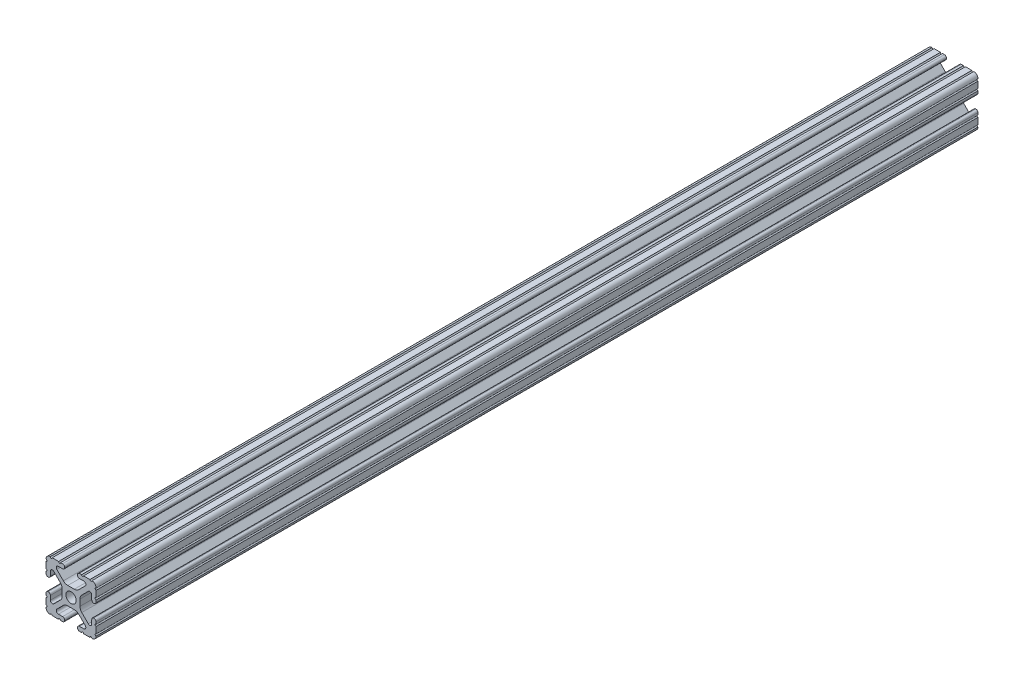
from build123d import *

# Parameters (mm, degrees)
SKETCH1_R           = 2.6035
BOSS_EXTRUDE1_DEPTH = 223.52


with BuildPart() as part:
    # Sketch1 → Boss-Extrude1 (new, symmetric)
    with BuildSketch(Plane.XY):
        with BuildLine():
            Line((-7.179650497, -8.645192506), (-3.952270251, -5.423690499))
            ThreePointArc((-3.952270251, -5.423690499), (-2.922936451, -4.736929036), (-1.709253557, -4.4958))
            Line((-1.709253557, -4.4958), (1.709253557, -4.4958))
            ThreePointArc((1.709253557, -4.4958), (2.922936451, -4.736929036), (3.952270251, -5.423690499))
            Line((3.952270251, -5.423690499), (7.179650497, -8.645192506))
            ThreePointArc((7.179650497, -8.645192506), (7.41473083, -9.822813117), (6.416408329, -10.4902))
            Line((6.416408329, -10.4902), (4.287512407, -10.4902))
            ThreePointArc((4.287512407, -10.4902), (3.54574862, -10.79744862), (3.2385, -11.539212407))
            Line((3.2385, -11.539212407), (3.2385, -11.650987593))
            ThreePointArc((3.2385, -11.650987593), (3.54574862, -12.39275138), (4.287512407, -12.7))
            Line((4.287512407, -12.7), (5.317126718, -12.7))
            ThreePointArc((5.317126718, -12.7), (5.825126718, -12.192), (6.333126718, -12.7))
            Line((6.333126718, -12.7), (9.550443118, -12.7))
            ThreePointArc((9.550443118, -12.7), (10.058366869, -12.192000006), (10.566443095, -12.699847501))
            ThreePointArc((10.566443095, -12.699847501), (12.082537762, -12.08250727), (12.699846982, -10.566399977))
            ThreePointArc((12.699846982, -10.566399977), (12.192000006, -10.058323491), (12.7, -9.5504))
            Line((12.7, -9.5504), (12.7, -6.3330836))
            ThreePointArc((12.7, -6.3330836), (12.192, -5.8250836), (12.7, -5.3170836))
            Line((12.7, -5.3170836), (12.7, -4.287469289))
            ThreePointArc((12.7, -4.287469289), (12.39275138, -3.545705502), (11.650987593, -3.238456882))
            Line((11.650987593, -3.238456882), (11.539212407, -3.238456882))
            ThreePointArc((11.539212407, -3.238456882), (10.79744862, -3.545705502), (10.4902, -4.287469289))
            Line((10.4902, -4.287469289), (10.4902, -6.402089023))
            ThreePointArc((10.4902, -6.402089023), (9.856505071, -7.351067942), (8.737131347, -7.129408934))
            Line((8.737131347, -7.129408934), (5.441005833, -3.840816462))
            ThreePointArc((5.441005833, -3.840816462), (4.750877967, -2.809883091), (4.5085, -1.593185507))
            Line((4.5085, -1.593185507), (4.5085, 1.593185507))
            ThreePointArc((4.5085, 1.593185507), (4.750877967, 2.809883091), (5.441005833, 3.840816462))
            Line((5.441005833, 3.840816462), (8.737131347, 7.129408934))
            ThreePointArc((8.737131347, 7.129408934), (9.856505071, 7.351067942), (10.4902, 6.402089023))
            Line((10.4902, 6.402089023), (10.4902, 4.287469289))
            ThreePointArc((10.4902, 4.287469289), (10.79744862, 3.545705502), (11.539212407, 3.238456882))
            Line((11.539212407, 3.238456882), (11.650987593, 3.238456882))
            ThreePointArc((11.650987593, 3.238456882), (12.39275138, 3.545705502), (12.7, 4.287469289))
            Line((12.7, 4.287469289), (12.7, 5.3170836))
            ThreePointArc((12.7, 5.3170836), (12.192, 5.8250836), (12.7, 6.3330836))
            Line((12.7, 6.3330836), (12.7, 9.5504))
            ThreePointArc((12.7, 9.5504), (12.192000006, 10.058323491), (12.699846982, 10.566399977))
            ThreePointArc((12.699846982, 10.566399977), (12.082537762, 12.08250727), (10.566443095, 12.699847501))
            ThreePointArc((10.566443095, 12.699847501), (10.058366869, 12.192000006), (9.550443118, 12.7))
            Line((9.550443118, 12.7), (6.333126718, 12.7))
            ThreePointArc((6.333126718, 12.7), (5.825126718, 12.192), (5.317126718, 12.7))
            Line((5.317126718, 12.7), (4.287512407, 12.7))
            ThreePointArc((4.287512407, 12.7), (3.54574862, 12.39275138), (3.2385, 11.650987593))
            Line((3.2385, 11.650987593), (3.2385, 11.539212407))
            ThreePointArc((3.2385, 11.539212407), (3.54574862, 10.79744862), (4.287512407, 10.4902))
            Line((4.287512407, 10.4902), (6.476788598, 10.4902))
            ThreePointArc((6.476788598, 10.4902), (7.432222385, 9.85140422), (7.207036008, 8.724370562))
            Line((7.207036008, 8.724370562), (3.898272566, 5.423169045))
            ThreePointArc((3.898272566, 5.423169045), (2.869120213, 4.736787962), (1.655778399, 4.4958))
            Line((1.655778399, 4.4958), (-1.655778399, 4.4958))
            ThreePointArc((-1.655778399, 4.4958), (-2.869120213, 4.736787962), (-3.898272566, 5.423169045))
            Line((-3.898272566, 5.423169045), (-7.207036008, 8.724370562))
            ThreePointArc((-7.207036008, 8.724370562), (-7.432222385, 9.85140422), (-6.476788598, 10.4902))
            Line((-6.476788598, 10.4902), (-4.287512407, 10.4902))
            ThreePointArc((-4.287512407, 10.4902), (-3.54574862, 10.79744862), (-3.2385, 11.539212407))
            Line((-3.2385, 11.539212407), (-3.2385, 11.650987593))
            ThreePointArc((-3.2385, 11.650987593), (-3.54574862, 12.39275138), (-4.287512407, 12.7))
            Line((-4.287512407, 12.7), (-5.317126718, 12.7))
            ThreePointArc((-5.317126718, 12.7), (-5.825126718, 12.192), (-6.333126718, 12.7))
            Line((-6.333126718, 12.7), (-9.550443118, 12.7))
            ThreePointArc((-9.550443118, 12.7), (-10.058366869, 12.192000006), (-10.566443095, 12.699847501))
            ThreePointArc((-10.566443095, 12.699847501), (-12.082537762, 12.08250727), (-12.699846982, 10.566399977))
            ThreePointArc((-12.699846982, 10.566399977), (-12.192000006, 10.058323491), (-12.7, 9.5504))
            Line((-12.7, 9.5504), (-12.7, 6.3330836))
            ThreePointArc((-12.7, 6.3330836), (-12.192, 5.8250836), (-12.7, 5.3170836))
            Line((-12.7, 5.3170836), (-12.7, 4.287469289))
            ThreePointArc((-12.7, 4.287469289), (-12.39275138, 3.545705502), (-11.650987593, 3.238456882))
            Line((-11.650987593, 3.238456882), (-11.539212407, 3.238456882))
            ThreePointArc((-11.539212407, 3.238456882), (-10.79744862, 3.545705502), (-10.4902, 4.287469289))
            Line((-10.4902, 4.287469289), (-10.4902, 6.402089023))
            ThreePointArc((-10.4902, 6.402089023), (-9.856505071, 7.351067942), (-8.737131347, 7.129408934))
            Line((-8.737131347, 7.129408934), (-5.441005833, 3.840816462))
            ThreePointArc((-5.441005833, 3.840816462), (-4.750877967, 2.809883091), (-4.5085, 1.593185507))
            Line((-4.5085, 1.593185507), (-4.5085, -1.593185507))
            ThreePointArc((-4.5085, -1.593185507), (-4.750877967, -2.809883091), (-5.441005833, -3.840816462))
            Line((-5.441005833, -3.840816462), (-8.737131347, -7.129408934))
            ThreePointArc((-8.737131347, -7.129408934), (-9.856505071, -7.351067942), (-10.4902, -6.402089023))
            Line((-10.4902, -6.402089023), (-10.4902, -4.287469289))
            ThreePointArc((-10.4902, -4.287469289), (-10.79744862, -3.545705502), (-11.539212407, -3.238456882))
            Line((-11.539212407, -3.238456882), (-11.650987593, -3.238456882))
            ThreePointArc((-11.650987593, -3.238456882), (-12.39275138, -3.545705502), (-12.7, -4.287469289))
            Line((-12.7, -4.287469289), (-12.7, -5.3170836))
            ThreePointArc((-12.7, -5.3170836), (-12.192, -5.8250836), (-12.7, -6.3330836))
            Line((-12.7, -6.3330836), (-12.7, -9.5504))
            ThreePointArc((-12.7, -9.5504), (-12.192000006, -10.058323491), (-12.699846982, -10.566399977))
            ThreePointArc((-12.699846982, -10.566399977), (-12.082537762, -12.08250727), (-10.566443095, -12.699847501))
            ThreePointArc((-10.566443095, -12.699847501), (-10.058366869, -12.192000006), (-9.550443118, -12.7))
            Line((-9.550443118, -12.7), (-6.333126718, -12.7))
            ThreePointArc((-6.333126718, -12.7), (-5.825126718, -12.192), (-5.317126718, -12.7))
            Line((-5.317126718, -12.7), (-4.287512407, -12.7))
            ThreePointArc((-4.287512407, -12.7), (-3.54574862, -12.39275138), (-3.2385, -11.650987593))
            Line((-3.2385, -11.650987593), (-3.2385, -11.539212407))
            ThreePointArc((-3.2385, -11.539212407), (-3.54574862, -10.79744862), (-4.287512407, -10.4902))
            Line((-4.287512407, -10.4902), (-6.416408329, -10.4902))
            ThreePointArc((-6.416408329, -10.4902), (-7.41473083, -9.822813117), (-7.179650497, -8.645192506))
        make_face()
        Circle(SKETCH1_R, mode=Mode.SUBTRACT)
    extrude(amount=BOSS_EXTRUDE1_DEPTH, both=True)


solid = part.part
